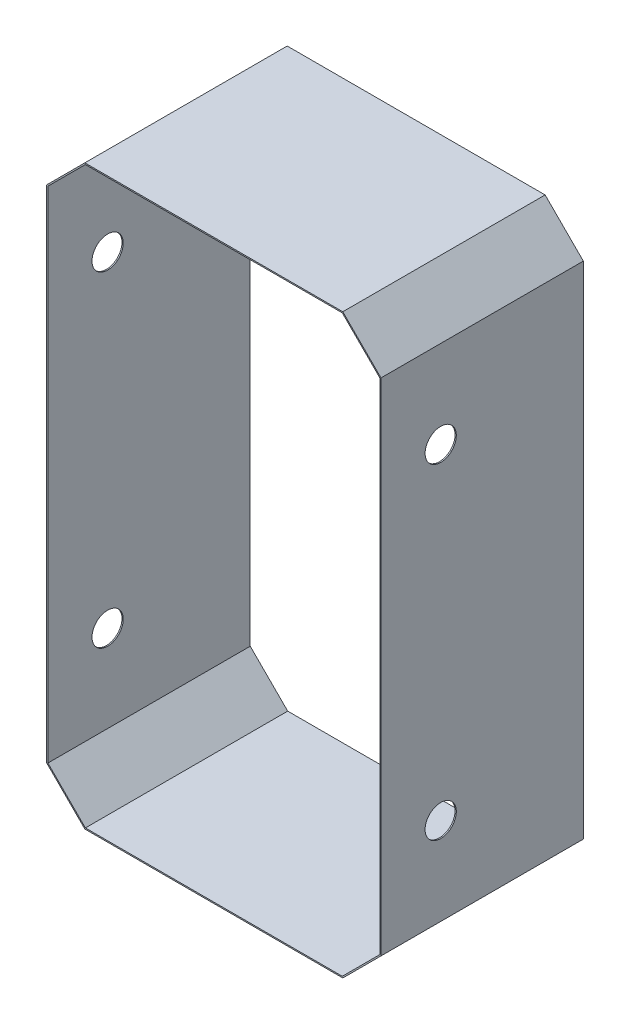
from build123d import *

# Parameters (mm, degrees)
BOSS_EXTRUDE1_DEPTH = 162
SKETCH2_R           = 12.5
CUT_EXTRUDE1_DEPTH  = 413.402232553


with BuildPart() as part:
    # Sketch1 → Boss-Extrude1 (new body)
    with BuildSketch(Plane.XY):
        Polygon((-57.739503943, 162.772609534), (-27.153717505, 193.358395972), (179.374709619, 193.358395972), (209.960496057, 162.772609534), (209.960496057, -238.055817591), (179.374709619, -268.641604028), (-27.153717505, -268.641604028), (-57.739503943, -238.055817591), align=None)
        Polygon((-56.739503943, 162.358395972), (-26.739503943, 192.358395972), (178.960496057, 192.358395972), (208.960496057, 162.358395972), (208.960496057, -237.641604028), (178.960496057, -267.641604028), (-26.739503943, -267.641604028), (-56.739503943, -237.641604028), align=None, mode=Mode.SUBTRACT)
    extrude(amount=BOSS_EXTRUDE1_DEPTH)

    # Sketch2 → Cut-Extrude1 (cut, through all)
    with BuildSketch(Plane(origin=(209.960496057, 0, 0), x_dir=(0, 0, -1), z_dir=(1, 0, 0))):
        with Locations(Location((-114.2, -168.055817591, 0), (0, 0, 90))):
            Circle(SKETCH2_R)
        with Locations(Location((-114.2, 92.772609534, 0), (0, 0, 90))):
            Circle(SKETCH2_R)
    extrude(amount=-CUT_EXTRUDE1_DEPTH, mode=Mode.SUBTRACT)


solid = part.part
